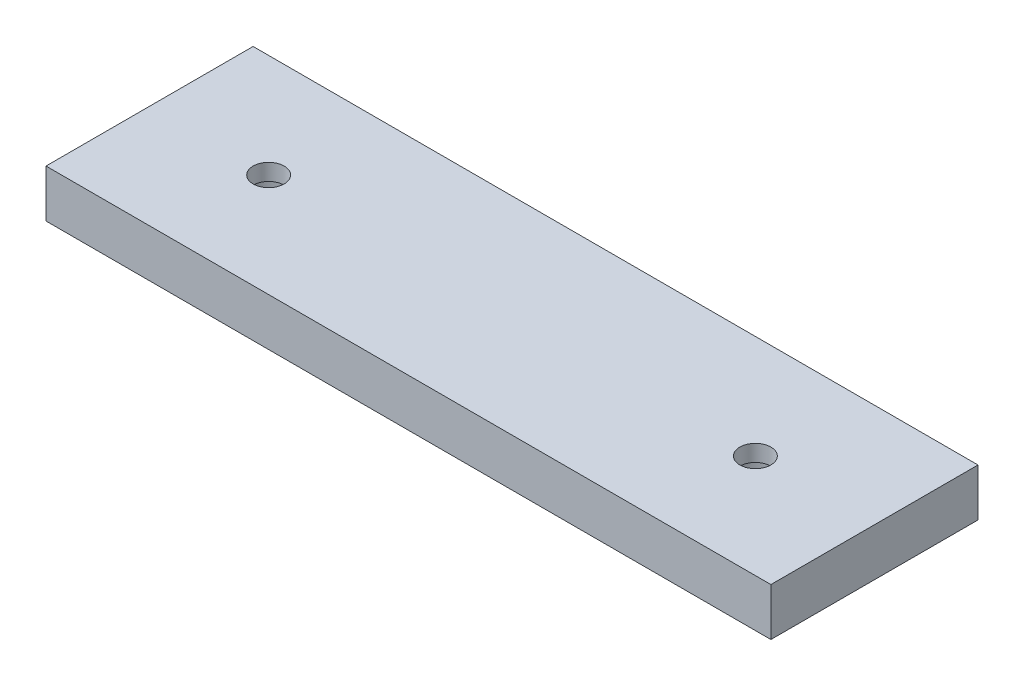
from build123d import *

# Parameters (mm, degrees)
IZIM1_W                     = 70
IZIM1_H                     = 20
Y_KSEKLIK_EKSTR_ZYON1_DEPTH = 4.6
IZIM2_R                     = 1.5
KES_EKSTR_ZYON1_DEPTH       = 4.6
IZIM3_R                     = 3
KES_EKSTR_ZYON2_DEPTH       = 3


with BuildPart() as part:
    # Çizim1 → Yükseklik-Ekstrüzyon1 (new body)
    with BuildSketch(Plane(origin=(0, 0, 0), x_dir=(1, 0, 0), z_dir=(0, 1, 0))):
        with Locations((35, 10)):
            Rectangle(IZIM1_W, IZIM1_H)
    extrude(amount=Y_KSEKLIK_EKSTR_ZYON1_DEPTH)

    # Çizim2 → Kes-Ekstrüzyon1 (cut)
    with BuildSketch(Plane.XZ):
        with Locations(Location((58.5, -10, 0), (0, 0, 270))):
            Circle(IZIM2_R)
        with Locations(Location((11.5, -10, 0), (0, 0, 270))):
            Circle(IZIM2_R)
    extrude(amount=-KES_EKSTR_ZYON1_DEPTH, mode=Mode.SUBTRACT)

    # Çizim3 → Kes-Ekstrüzyon2 (cut)
    with BuildSketch(Plane.XZ):
        with Locations(Location((11.5, -10, 0), (0, 0, 270))):
            Circle(IZIM3_R)
        with Locations(Location((58.5, -10, 0), (0, 0, 270))):
            Circle(IZIM3_R)
    extrude(amount=-KES_EKSTR_ZYON2_DEPTH, mode=Mode.SUBTRACT)


solid = part.part
